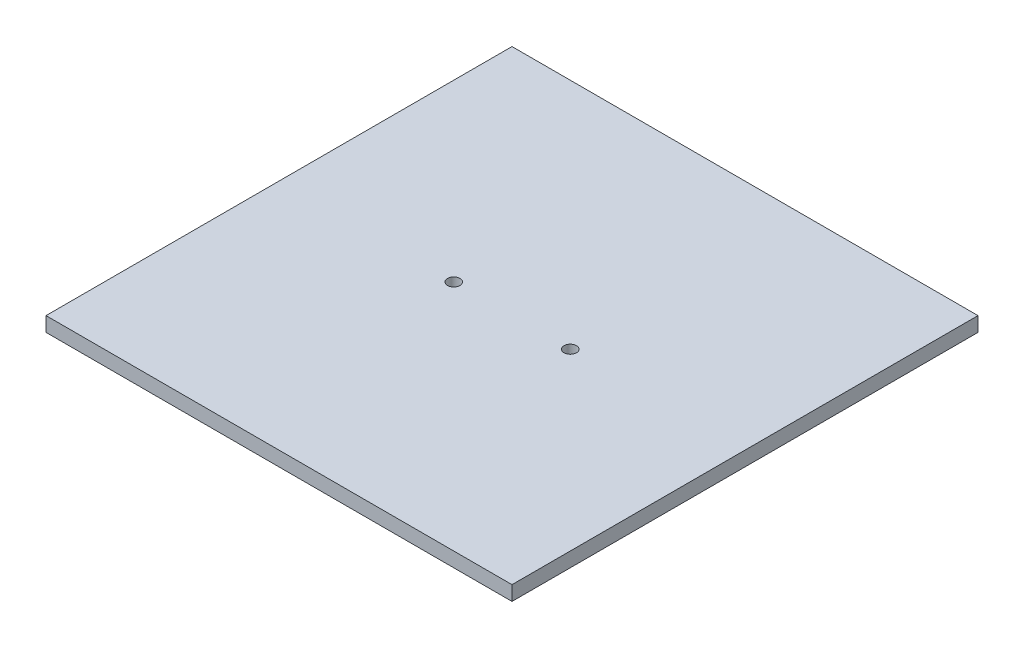
from build123d import *

# Parameters (mm, degrees)
SKETCH1_W             = 101.6
SKETCH1_H             = 101.6
BOSS_EXTRUDE1_DEPTH   = 3.175
F_6_32_TAPPED_HOLE1_D = 2.7051


with BuildPart() as part:
    # Sketch1 → Boss-Extrude1 (new body)
    with BuildSketch(Plane(origin=(0, 0, 0), x_dir=(1, 0, 0), z_dir=(0, 1, 0))):
        Rectangle(SKETCH1_W, SKETCH1_H)
    extrude(amount=BOSS_EXTRUDE1_DEPTH)

    # #6-32 Tapped Hole1 (through all)
    with Locations(Plane(origin=(0, 3.175, 0), x_dir=(1, 0, 0), z_dir=(0, 1, 0))):
        with Locations((-12.7, 0), (12.7, 0)):
            Hole(F_6_32_TAPPED_HOLE1_D / 2)


solid = part.part
